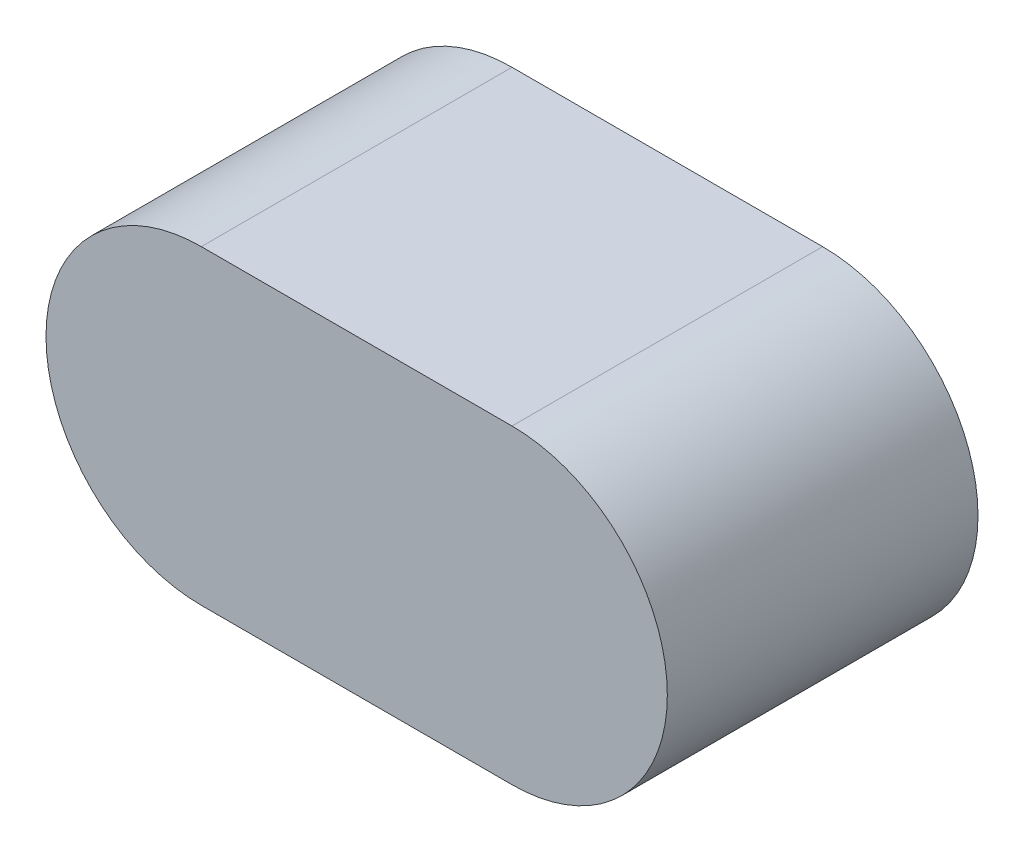
from build123d import *

# Parameters (mm, degrees)
EXTRUDE_1_DEPTH = 5


with BuildPart() as part:
    # 草图1 → 凸台-拉伸1 (new body)
    with BuildSketch(Plane.XY):
        with BuildLine():
            Line((-50.79787234, 51.329787234), (-45.79787234, 51.329787234))
            ThreePointArc((-45.79787234, 51.329787234), (-43.29787234, 48.829787234), (-45.79787234, 46.329787234))
            Line((-45.79787234, 46.329787234), (-50.79787234, 46.329787234))
            ThreePointArc((-50.79787234, 46.329787234), (-53.29787234, 48.829787234), (-50.79787234, 51.329787234))
        make_face()
    extrude(amount=EXTRUDE_1_DEPTH)


solid = part.part
